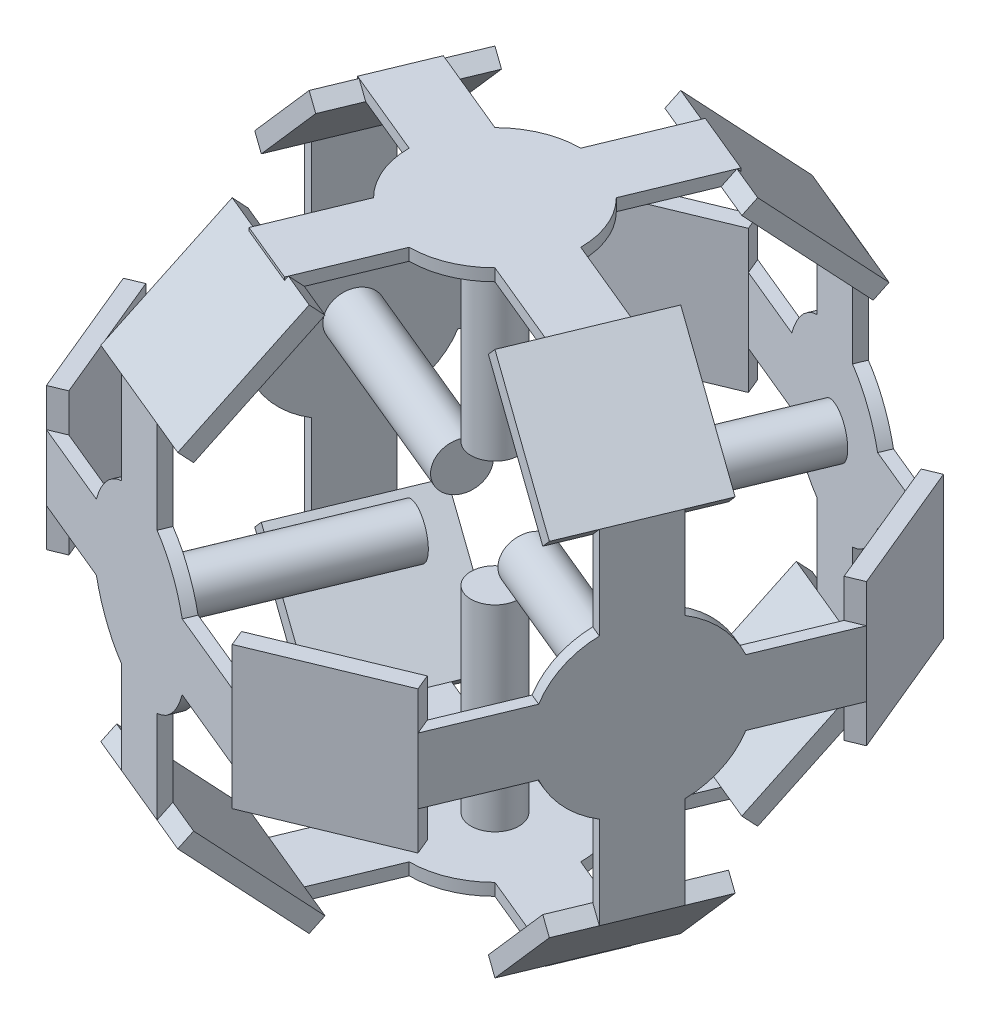
from build123d import *

# Parameters (mm, degrees)
SKETCH2_W            = 41.421356238
SKETCH2_H            = 41.421356238
BOSS_EXTRUDE1_DEPTH  = 5
SKETCH4_W            = 41.421356238
SKETCH4_H            = 41.421356238
BOSS_EXTRUDE2_DEPTH  = 5
SKETCH7_W            = 41.421356238
SKETCH7_H            = 41.421356238
BOSS_EXTRUDE3_DEPTH  = 5
SKETCH6_W            = 41.421356238
SKETCH6_H            = 41.421356238
BOSS_EXTRUDE4_DEPTH  = 5
SKETCH12_W           = 41.421356238
SKETCH12_H           = 41.421356237
BOSS_EXTRUDE5_DEPTH  = 5
SKETCH16_W           = 41.421356238
SKETCH16_H           = 41.421356238
BOSS_EXTRUDE6_DEPTH  = 5
SKETCH14_W           = 41.421356238
SKETCH14_H           = 41.421356237
BOSS_EXTRUDE7_DEPTH  = 5
SKETCH13_W           = 41.421356238
SKETCH13_H           = 41.421356237
BOSS_EXTRUDE8_DEPTH  = 5
SKETCH11_W           = 41.421356238
SKETCH11_H           = 41.421356237
BOSS_EXTRUDE9_DEPTH  = 5
SKETCH17_W           = 41.421356238
SKETCH17_H           = 41.421356238
BOSS_EXTRUDE10_DEPTH = 5
SKETCH19_W           = 41.421356238
SKETCH19_H           = 41.421356238
BOSS_EXTRUDE11_DEPTH = 5
SKETCH18_W           = 41.421356238
SKETCH18_H           = 41.421356238
BOSS_EXTRUDE12_DEPTH = 5
BOSS_EXTRUDE14_DEPTH = 3.5355
BOSS_EXTRUDE15_DEPTH = 3.5355
BOSS_EXTRUDE16_START = 3.5355
BOSS_EXTRUDE16_DEPTH = 3.5355
BOSS_EXTRUDE17_DEPTH = 3.5355
BOSS_EXTRUDE18_START = 3.5355
BOSS_EXTRUDE18_DEPTH = 3.5355
BOSS_EXTRUDE19_START = 3.5355
BOSS_EXTRUDE19_DEPTH = 3.5355
SKETCH31_R           = 7
BOSS_EXTRUDE20_DEPTH = 58
BOSS_EXTRUDE21_START = 57.255
SKETCH32_R           = 7
BOSS_EXTRUDE21_DEPTH = 57.255
SKETCH33_R           = 7
BOSS_EXTRUDE22_DEPTH = 58
SKETCH34_R           = 7
BOSS_EXTRUDE23_DEPTH = 57.255
BOSS_EXTRUDE24_START = 57.255
SKETCH35_R           = 7
BOSS_EXTRUDE24_DEPTH = 57.255
BOSS_EXTRUDE25_START = 58
SKETCH36_R           = 7
BOSS_EXTRUDE25_DEPTH = 58


with BuildPart() as part:
    # Sketch2 → Boss-Extrude1 (new body)
    with BuildSketch(Plane(origin=(-23.096988313, -25, -9.567085809), x_dir=(-0.3826834323650831, 0, 0.9238795325112896), z_dir=(-0.6532814824381868, -0.7071067811865513, -0.27059805007309234))):
        with Locations((0, 56.066017178)):
            Rectangle(SKETCH2_W, SKETCH2_H)
    extrude(amount=-BOSS_EXTRUDE1_DEPTH)



with BuildPart() as body_2:
    # Sketch4 → Boss-Extrude2 (new body)
    with BuildSketch(Plane(origin=(9.567085809, -25, -23.096988313), x_dir=(-0.9238795325112895, 0, -0.3826834323650832), z_dir=(0.27059805007309246, -0.7071067811865513, -0.6532814824381868))):
        with Locations((0, 56.066017178)):
            Rectangle(SKETCH4_W, SKETCH4_H)
    extrude(amount=-BOSS_EXTRUDE2_DEPTH)


with BuildPart() as body_3:
    # Sketch7 → Boss-Extrude3 (new body)
    with BuildSketch(Plane(origin=(-9.567085809, -25, 23.096988313), x_dir=(0.9238795325112897, 0, 0.38268343236508273), z_dir=(-0.27059805007309207, -0.7071067811865512, 0.653281482438187))):
        with Locations((0, 56.066017178)):
            Rectangle(SKETCH7_W, SKETCH7_H)
    extrude(amount=-BOSS_EXTRUDE3_DEPTH)


with BuildPart() as body_4:
    # Sketch6 → Boss-Extrude4 (new body)
    with BuildSketch(Plane(origin=(23.096988313, -25, 9.567085809), x_dir=(0.38268343236508284, 0, -0.9238795325112896), z_dir=(0.6532814824381868, -0.7071067811865512, 0.2705980500730922))):
        with Locations((0, 56.066017178)):
            Rectangle(SKETCH6_W, SKETCH6_H)
    extrude(amount=-BOSS_EXTRUDE4_DEPTH)


with BuildPart() as body_5:
    # Sketch12 → Boss-Extrude5 (new body)
    with BuildSketch(Plane(origin=(-34.985438396, 0, -84.462319862), x_dir=(-0.9238795325112804, 3.134019250618537e-15, 0.382683432365105), z_dir=(-0.382683432365105, -7.566191779581278e-15, -0.9238795325112804))):
        with Locations((0, 79.289321882)):
            Rectangle(SKETCH12_W, SKETCH12_H)
    extrude(amount=-BOSS_EXTRUDE5_DEPTH)


with BuildPart() as body_6:
    # Sketch16 → Boss-Extrude6 (new body)
    with BuildSketch(Plane(origin=(-39.909795657, 104.289321881, 96.350769946), x_dir=(0.9238795325112895, 0, 0.38268343236508306), z_dir=(-0.27059805007309806, 0.7071067811865364, 0.6532814824382006))):
        with Locations((0, 56.066017178)):
            Rectangle(SKETCH16_W, SKETCH16_H)
    extrude(amount=-BOSS_EXTRUDE6_DEPTH)


with BuildPart() as body_7:
    # Sketch14 → Boss-Extrude7 (new body)
    with BuildSketch(Plane(origin=(34.985438396, 0, 84.462319862), x_dir=(0.9238795325112841, 3.08091125589919e-15, -0.38268343236509633), z_dir=(0.3826834323650964, -7.4379777384596e-15, 0.9238795325112842))):
        with Locations((0, 79.289321882)):
            Rectangle(SKETCH14_W, SKETCH14_H)
    extrude(amount=-BOSS_EXTRUDE7_DEPTH)


with BuildPart() as body_8:
    # Sketch13 → Boss-Extrude8 (new body)
    with BuildSketch(Plane(origin=(-84.462319862, 0, 34.985438396), x_dir=(-0.3826834323650926, -1.0166004376210155e-15, -0.9238795325112856), z_dir=(0.9238795325112856, 2.4542905640190584e-15, -0.3826834323650926))):
        with Locations((0, 79.289321882)):
            Rectangle(SKETCH13_W, SKETCH13_H)
    extrude(amount=BOSS_EXTRUDE8_DEPTH)


with BuildPart() as body_9:
    # Sketch11 → Boss-Extrude9 (new body)
    with BuildSketch(Plane(origin=(84.462319862, 0, -34.985438396), x_dir=(-0.3826834323650965, 3.2356792943805835e-15, -0.923879532511284), z_dir=(0.9238795325112841, -7.81162083598325e-15, -0.38268343236509655))):
        with Locations((0, 79.289321882)):
            Rectangle(SKETCH11_W, SKETCH11_H)
    extrude(amount=-BOSS_EXTRUDE9_DEPTH)


with BuildPart() as body_10:
    # Sketch17 → Boss-Extrude10 (new body)
    with BuildSketch(Plane(origin=(-96.350769946, 104.289321881, -39.909795657), x_dir=(0.382683432365083, 0, -0.9238795325112896), z_dir=(0.6532814824381961, -0.7071067811865414, 0.2705980500730961))):
        with Locations((0, 56.066017178)):
            Rectangle(SKETCH17_W, SKETCH17_H)
    extrude(amount=BOSS_EXTRUDE10_DEPTH)


with BuildPart() as body_11:
    # Sketch19 → Boss-Extrude11 (new body)
    with BuildSketch(Plane(origin=(96.350769946, 104.289321881, 39.909795657), x_dir=(0.38268343236508257, 0, -0.9238795325112898), z_dir=(0.6532814824382007, 0.7071067811865364, 0.2705980500730977))):
        with Locations((0, 56.066017178)):
            Rectangle(SKETCH19_W, SKETCH19_H)
    extrude(amount=-BOSS_EXTRUDE11_DEPTH)


with BuildPart() as body_12:
    # Sketch18 → Boss-Extrude12 (new body)
    with BuildSketch(Plane(origin=(39.909795657, 104.289321881, -96.350769946), x_dir=(-0.9238795325112894, 0, -0.3826834323650834), z_dir=(0.27059805007309823, 0.7071067811865364, -0.6532814824382004))):
        with Locations((0, 56.066017178)):
            Rectangle(SKETCH18_W, SKETCH18_H)
    extrude(amount=-BOSS_EXTRUDE12_DEPTH)


with BuildPart() as part_1:
    add(part.part)

    add(body_2.part)  # Boss-Extrude14 merges body 2

    add(body_3.part)  # Boss-Extrude14 merges body 3

    add(body_4.part)  # Boss-Extrude14 merges body 4
    # Sketch24 → Boss-Extrude14 (add)
    with BuildSketch(Plane(origin=(0, 0, 0), x_dir=(1, 0, 0), z_dir=(0, 1, 0))):
        with BuildLine():
            Line((49.967853732, -10.342023639), (25, 0))
            ThreePointArc((25, 0), (23.096988313, 9.567085809), (17.67766953, 17.67766953))
            Line((17.67766953, 17.67766953), (28.038118816, 42.690006709))
            Line((28.038118816, 42.690006709), (10.360449286, 50.012337179))
            Line((10.360449286, 50.012337179), (0, 25))
            ThreePointArc((0, 25), (-9.567085809, 23.096988313), (-17.67766953, 17.67766953))
            Line((-17.67766953, 17.67766953), (-42.120869604, 27.802374508))
            Line((-42.120869604, 27.802374508), (-49.443200075, 10.124704979))
            Line((-49.443200075, 10.124704979), (-25, 0))
            ThreePointArc((-25, 0), (-23.096988313, -9.567085809), (-17.67766953, -17.67766953))
            Line((-17.67766953, -17.67766953), (-27.791626266, -42.094921051))
            Line((-27.791626266, -42.094921051), (-10.113956736, -49.417251522))
            Line((-10.113956736, -49.417251522), (0, -25))
            ThreePointArc((0, -25), (9.567085809, -23.096988313), (17.67766953, -17.67766953))
            Line((17.67766953, -17.67766953), (42.645523262, -28.019693169))
            Line((42.645523262, -28.019693169), (49.967853732, -10.342023639))
        make_face()
    extrude(amount=BOSS_EXTRUDE14_DEPTH)


    add(body_5.part)  # Boss-Extrude15 merges body 5

    add(body_8.part)  # Boss-Extrude15 merges body 8

    add(body_10.part)  # Boss-Extrude15 merges body 10
    # Sketch26 → Boss-Extrude15 (add)
    with BuildSketch(Plane(origin=(-73.253781633, 0, -30.342709847), x_dir=(-0.3826834323650829, 0, 0.9238795325112896), z_dir=(-0.9238795325112897, -3.5388358909926865e-15, -0.38268343236508295))):
        with BuildLine():
            Line((23.096988313, 69.722236072), (50.094720062, 69.722236072))
            Line((50.094720062, 69.722236072), (50.094720062, 88.85640769))
            Line((50.094720062, 88.85640769), (23.096988313, 88.85640769))
            ThreePointArc((23.096988313, 88.85640769), (17.67766953, 96.966991411), (9.567085809, 102.386310194))
            Line((9.567085809, 102.386310194), (9.567085809, 130.754627768))
            Line((9.567085809, 130.754627768), (-9.567085809, 130.754627768))
            Line((-9.567085809, 130.754627768), (-9.567085809, 102.386310194))
            ThreePointArc((-9.567085809, 102.386310194), (-17.67766953, 96.966991411), (-23.096988313, 88.85640769))
            Line((-23.096988313, 88.85640769), (-50.797318042, 88.85640769))
            Line((-50.797318042, 88.85640769), (-50.797318042, 69.722236072))
            Line((-50.797318042, 69.722236072), (-23.096988313, 69.722236072))
            ThreePointArc((-23.096988313, 69.722236072), (-17.67766953, 61.611652352), (-9.567085809, 56.192333569))
            Line((-9.567085809, 56.192333569), (-9.567085809, 28.076120623))
            Line((-9.567085809, 28.076120623), (9.567085809, 28.076120623))
            Line((9.567085809, 28.076120623), (9.567085809, 56.192333569))
            ThreePointArc((9.567085809, 56.192333569), (17.67766953, 61.611652352), (23.096988313, 69.722236072))
        make_face()
    extrude(amount=-BOSS_EXTRUDE15_DEPTH)


    add(body_7.part)  # Boss-Extrude16 merges body 7

    add(body_9.part)  # Boss-Extrude16 merges body 9

    add(body_11.part)  # Boss-Extrude16 merges body 11
    # Sketch27 → Boss-Extrude16 (add)
    with BuildSketch(Plane(origin=(73.253781633, 0, 30.342709847), x_dir=(-0.3826834323650828, 0, 0.9238795325112897), z_dir=(-0.9238795325112896, 1.0463852007092099e-14, -0.38268343236508273)).offset(BOSS_EXTRUDE16_START)):
        with BuildLine():
            Line((-9.567085809, 29.289321881), (9.567085809, 29.289321881))
            Line((9.567085809, 29.289321881), (9.567085809, 56.192333569))
            ThreePointArc((9.567085809, 56.192333569), (17.67766953, 61.611652352), (23.096988313, 69.722236072))
            Line((23.096988313, 69.722236072), (50, 69.722236072))
            Line((50, 69.722236072), (50, 88.85640769))
            Line((50, 88.85640769), (23.096988313, 88.85640769))
            ThreePointArc((23.096988313, 88.85640769), (17.67766953, 96.966991411), (9.567085809, 102.386310194))
            Line((9.567085809, 102.386310194), (9.567085809, 129.289321881))
            Line((9.567085809, 129.289321881), (-9.567085809, 129.289321881))
            Line((-9.567085809, 129.289321881), (-9.567085809, 102.386310194))
            ThreePointArc((-9.567085809, 102.386310194), (-17.67766953, 96.966991411), (-23.096988313, 88.85640769))
            Line((-23.096988313, 88.85640769), (-50, 88.85640769))
            Line((-50, 88.85640769), (-50, 69.722236072))
            Line((-50, 69.722236072), (-23.096988313, 69.722236072))
            ThreePointArc((-23.096988313, 69.722236072), (-17.67766953, 61.611652352), (-9.567085809, 56.192333569))
            Line((-9.567085809, 56.192333569), (-9.567085809, 29.289321881))
        make_face()
    extrude(amount=-BOSS_EXTRUDE16_DEPTH)


    add(body_12.part)  # Boss-Extrude17 merges body 12
    # Sketch28 → Boss-Extrude17 (add)
    with BuildSketch(Plane(origin=(30.342709847, 0, -73.253781633), x_dir=(0.9238795325112894, 0, 0.38268343236508334), z_dir=(-0.38268343236508334, 1.043609643147647e-14, 0.9238795325112894))):
        with BuildLine():
            Line((23.096988313, 88.85640769), (50.063514463, 88.85640769))
            Line((50.063514463, 88.85640769), (50.063514463, 69.722236072))
            Line((50.063514463, 69.722236072), (23.096988313, 69.722236072))
            ThreePointArc((23.096988313, 69.722236072), (17.67766953, 61.611652352), (9.567085809, 56.192333569))
            Line((9.567085809, 56.192333569), (9.567085809, 29.225807419))
            Line((9.567085809, 29.225807419), (-9.567085809, 29.225807419))
            Line((-9.567085809, 29.225807419), (-9.567085809, 56.192333569))
            ThreePointArc((-9.567085809, 56.192333569), (-17.67766953, 61.611652352), (-23.096988313, 69.722236072))
            Line((-23.096988313, 69.722236072), (-50.063514463, 69.722236072))
            Line((-50.063514463, 69.722236072), (-50.063514463, 88.85640769))
            Line((-50.063514463, 88.85640769), (-23.096988313, 88.85640769))
            ThreePointArc((-23.096988313, 88.85640769), (-17.67766953, 96.966991411), (-9.567085809, 102.386310194))
            Line((-9.567085809, 102.386310194), (-9.567085809, 129.352836344))
            Line((-9.567085809, 129.352836344), (9.567085809, 129.352836344))
            Line((9.567085809, 129.352836344), (9.567085809, 102.386310194))
            ThreePointArc((9.567085809, 102.386310194), (17.67766953, 96.966991411), (23.096988313, 88.85640769))
        make_face()
    extrude(amount=BOSS_EXTRUDE17_DEPTH)


    add(body_6.part)  # Boss-Extrude18 merges body 6
    # Sketch29 → Boss-Extrude18 (add)
    with BuildSketch(Plane(origin=(0, 158.578643763, 0), x_dir=(-1, 0, 0), z_dir=(0, -1, 0)).offset(BOSS_EXTRUDE18_START)):
        with BuildLine():
            Line((17.67766953, 17.67766953), (43.338953725, 28.306921471))
            Line((43.338953725, 28.306921471), (50.661284196, 10.629251942))
            Line((50.661284196, 10.629251942), (25, 0))
            ThreePointArc((25, 0), (23.096988313, -9.567085809), (17.67766953, -17.67766953))
            Line((17.67766953, -17.67766953), (28.306921471, -43.338953725))
            Line((28.306921471, -43.338953725), (10.629251942, -50.661284196))
            Line((10.629251942, -50.661284196), (0, -25))
            ThreePointArc((0, -25), (-9.567085809, -23.096988313), (-17.67766953, -17.67766953))
            Line((-17.67766953, -17.67766953), (-42.53281139, -27.973006383))
            Line((-42.53281139, -27.973006383), (-49.855141861, -10.295336853))
            Line((-49.855141861, -10.295336853), (-25, 0))
            ThreePointArc((-25, 0), (-23.096988313, 9.567085809), (-17.67766953, 17.67766953))
            Line((-17.67766953, 17.67766953), (-28.306921471, 43.338953725))
            Line((-28.306921471, 43.338953725), (-10.629251942, 50.661284196))
            Line((-10.629251942, 50.661284196), (0, 25))
            ThreePointArc((0, 25), (9.567085809, 23.096988313), (17.67766953, 17.67766953))
        make_face()
    extrude(amount=-BOSS_EXTRUDE18_DEPTH)

    # Sketch30 → Boss-Extrude19 (add)
    with BuildSketch(Plane(origin=(-30.342709847, 0, 73.253781633), x_dir=(-0.9238795325112896, 0, -0.3826834323650829), z_dir=(0.38268343236508295, 1.0436096431476471e-14, -0.9238795325112897)).offset(BOSS_EXTRUDE19_START)):
        with BuildLine():
            Line((-9.567085809, 102.386310194), (-9.567085809, 129.289321881))
            Line((-9.567085809, 129.289321881), (9.567085809, 129.289321881))
            Line((9.567085809, 129.289321881), (9.567085809, 102.386310194))
            ThreePointArc((9.567085809, 102.386310194), (17.67766953, 96.966991411), (23.096988313, 88.85640769))
            Line((23.096988313, 88.85640769), (50, 88.85640769))
            Line((50, 88.85640769), (50, 69.722236072))
            Line((50, 69.722236072), (23.096988313, 69.722236072))
            ThreePointArc((23.096988313, 69.722236072), (17.67766953, 61.611652352), (9.567085809, 56.192333569))
            Line((9.567085809, 56.192333569), (9.567085809, 29.289321881))
            Line((9.567085809, 29.289321881), (-9.567085809, 29.289321881))
            Line((-9.567085809, 29.289321881), (-9.567085809, 56.192333569))
            ThreePointArc((-9.567085809, 56.192333569), (-17.67766953, 61.611652352), (-23.096988313, 69.722236072))
            Line((-23.096988313, 69.722236072), (-50, 69.722236072))
            Line((-50, 69.722236072), (-50, 88.85640769))
            Line((-50, 88.85640769), (-23.096988313, 88.85640769))
            ThreePointArc((-23.096988313, 88.85640769), (-17.67766953, 96.966991411), (-9.567085809, 102.386310194))
        make_face()
    extrude(amount=-BOSS_EXTRUDE19_DEPTH)

    # Sketch31 → Boss-Extrude20 (add)
    with BuildSketch(Plane.XZ.offset(-155.043143763)):
        Circle(SKETCH31_R)
    extrude(amount=BOSS_EXTRUDE20_DEPTH)

    # Sketch32 → Boss-Extrude21 (add)
    with BuildSketch(Plane(origin=(0, 3.5355, 0), x_dir=(1, 0, 0), z_dir=(0, 1, 0)).offset(BOSS_EXTRUDE21_START)):
        Circle(SKETCH32_R)
    extrude(amount=-BOSS_EXTRUDE21_DEPTH)

    # Sketch33 → Boss-Extrude22 (add)
    with BuildSketch(Plane(origin=(-28.989732572, 0, 69.987405546), x_dir=(-0.9238795325112896, 4.3227726801509234e-15, -0.38268343236508306), z_dir=(0.38268343236508306, 1.0436096431476475e-14, -0.9238795325112896))):
        with Locations((0, 79.289321881)):
            Circle(SKETCH33_R)
    extrude(amount=BOSS_EXTRUDE22_DEPTH)

    # Sketch34 → Boss-Extrude23 (add)
    with BuildSketch(Plane(origin=(69.987405546, 0, 28.989732572), x_dir=(-0.3826834323650826, 4.2767857367450595e-15, 0.9238795325112896), z_dir=(-0.9238795325112897, 1.0325074129013957e-14, -0.3826834323650827))):
        with Locations((0, 79.289321881)):
            Circle(SKETCH34_R)
    extrude(amount=BOSS_EXTRUDE23_DEPTH)

    # Sketch35 → Boss-Extrude24 (add)
    with BuildSketch(Plane(origin=(28.989732572, 0, -69.987405546), x_dir=(0.9238795325112894, 4.322772680150929e-15, 0.3826834323650834), z_dir=(-0.3826834323650834, 1.043609643147647e-14, 0.9238795325112894)).offset(BOSS_EXTRUDE24_START)):
        with Locations((0, 79.289321881)):
            Circle(SKETCH35_R)
    extrude(amount=-BOSS_EXTRUDE24_DEPTH)

    # Sketch36 → Boss-Extrude25 (add)
    with BuildSketch(Plane(origin=(-69.987405546, 0, -28.989732572), x_dir=(0.38268343236508306, 1.465833821061816e-15, -0.9238795325112896), z_dir=(0.9238795325112896, 3.538835890992687e-15, 0.38268343236508306)).offset(BOSS_EXTRUDE25_START)):
        with Locations((0, 79.289321881)):
            Circle(SKETCH36_R)
    extrude(amount=-BOSS_EXTRUDE25_DEPTH)


solid = part_1.part
